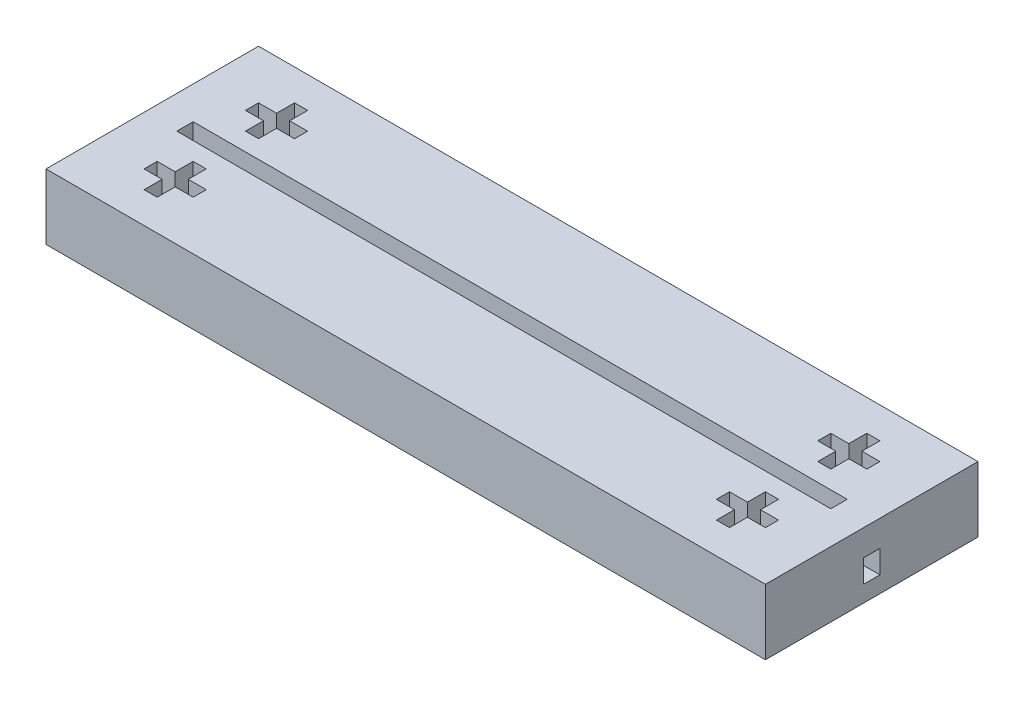
from build123d import *

# Parameters (mm, degrees)
SKICA1_W                 = 220
SKICA1_H                 = 65
P_IDAT_VYSUNUT_M1_DEPTH  = 20
SKICA2_W                 = 200
SKICA2_H                 = 5
ODEBRAT_VYSUNUT_M1_DEPTH = 15
SKICA3_W                 = 5
SKICA3_H                 = 7
ODEBRAT_VYSUNUT_M2_DEPTH = 35


with BuildPart() as part:
    # Skica1 → Přidat vysunutím1 (new body)
    with BuildSketch(Plane(origin=(0, 0, 0), x_dir=(1, 0, 0), z_dir=(0, 1, 0))):
        with Locations((110, 32.5)):
            Rectangle(SKICA1_W, SKICA1_H)
    extrude(amount=P_IDAT_VYSUNUT_M1_DEPTH)

    # Skica2 → Odebrat vysunutím1 (cut)
    with BuildSketch(Plane(origin=(0, 20, 0), x_dir=(1, 0, 0), z_dir=(0, 1, 0))):
        with Locations((110, 32.5)):
            Rectangle(SKICA2_W, SKICA2_H)
        Polygon((24.5, 50), (30, 50), (30, 46), (24.5, 46), (24.5, 40.5), (20.5, 40.5), (20.5, 46), (15, 46), (15, 50), (20.5, 50), (20.5, 55.5), (24.5, 55.5), align=None)
        Polygon((15, 15), (15, 19), (20.5, 19), (20.5, 24.5), (24.5, 24.5), (24.5, 19), (30, 19), (30, 15), (24.5, 15), (24.5, 9.5), (20.5, 9.5), (20.5, 15), align=None)
        Polygon((205, 15), (199.5, 15), (199.5, 9.5), (195.5, 9.5), (195.5, 15), (190, 15), (190, 19), (195.5, 19), (195.5, 24.5), (199.5, 24.5), (199.5, 19), (205, 19), align=None)
        Polygon((205, 50), (205, 46), (199.5, 46), (199.5, 40.5), (195.5, 40.5), (195.5, 46), (190, 46), (190, 50), (195.5, 50), (195.5, 55.5), (199.5, 55.5), (199.5, 50), align=None)
    extrude(amount=-ODEBRAT_VYSUNUT_M1_DEPTH, mode=Mode.SUBTRACT)

    # Skica3 → Odebrat vysunutím2 (cut)
    with BuildSketch(Plane(origin=(220, 0, 0), x_dir=(0, 0, -1), z_dir=(1, 0, 0))):
        with Locations((32.5, 8.5)):
            Rectangle(SKICA3_W, SKICA3_H)
    extrude(amount=-ODEBRAT_VYSUNUT_M2_DEPTH, mode=Mode.SUBTRACT)


solid = part.part
